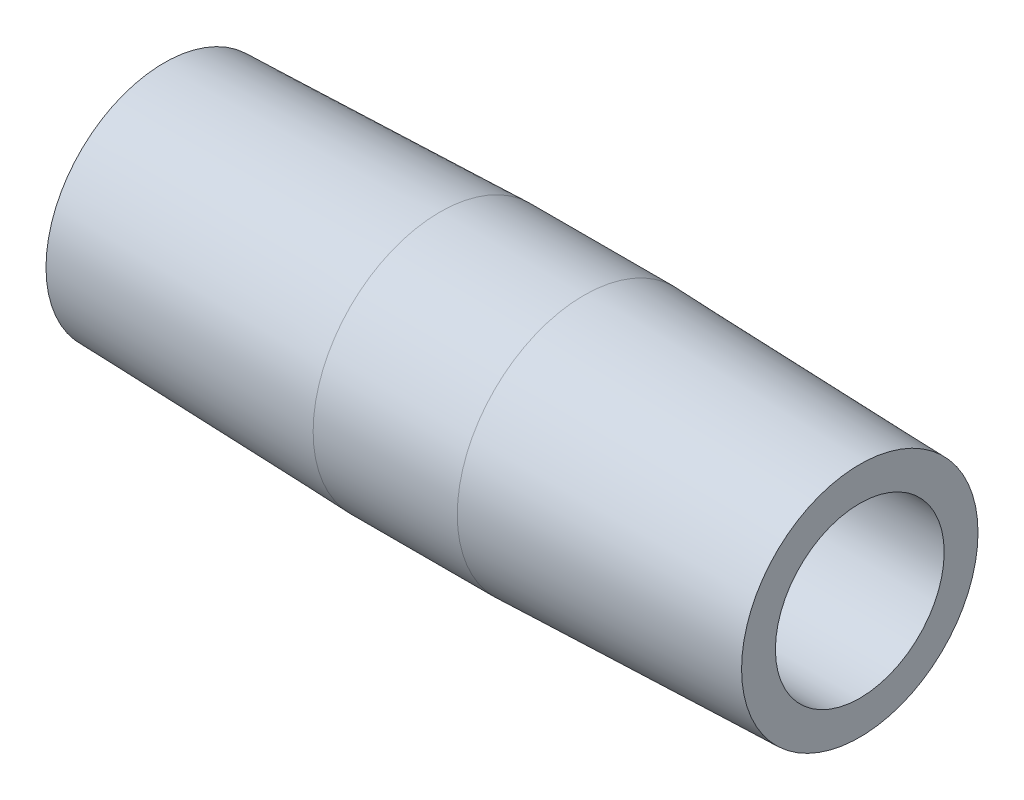
from build123d import *

# Parameters (mm, degrees)
SKETCH2_R          = 6.9453125
EXTRUDE1_DEPTH     = 15.10284
EXTRUDE1_TAPER     = 1.783333333
SKETCH11_R         = 6.9453125
EXTRUDE4_DEPTH     = 3.94716
SKETCH13_R         = 6.598046875
EXTRUDE5_DEPTH     = 1.058333333
CIRPATTERN1_COUNT  = 2
SKETCH5_R          = 4.6228
CUT_EXTRUDE3_DEPTH = 40.345708049


with BuildPart() as part:
    # Sketch2 → Extrude1 (new body)
    with BuildSketch(Plane(origin=(3.94716, 0, 0), x_dir=(0, 0, -1), z_dir=(1, 0, 0))):
        Circle(SKETCH2_R)
    extrude(amount=EXTRUDE1_DEPTH, taper=EXTRUDE1_TAPER)



with BuildPart() as body_2:
    # Sketch11 → Extrude4 (new body)
    with BuildSketch(Plane.ZY.offset(-3.94716)):
        Circle(SKETCH11_R)
    extrude(amount=EXTRUDE4_DEPTH)


with BuildPart() as part_1:
    add(part.part)

    add(body_2.part)  # Extrude5 merges body 2
    # Sketch13 → Extrude5 (add)
    with BuildSketch(Plane.ZY.offset(-3.94716)):
        Circle(SKETCH13_R)
    extrude(amount=EXTRUDE5_DEPTH)


with BuildPart() as cirpattern1_1:
    # CirPattern1: pattern copy
    add(part_1.part.rotate(Axis((0, 27.182238006, 0), (0, -1, 0)), 1 * 360 / CIRPATTERN1_COUNT))


with BuildPart() as part_2:
    add(part_1.part)

    # Combine1: union CirPattern1_1
    add(cirpattern1_1.part)

    # Sketch5 → Cut-Extrude3 (cut, through all)
    with BuildSketch(Plane(origin=(19.05, 0, 0), x_dir=(0, 0, -1), z_dir=(1, 0, 0))):
        Circle(SKETCH5_R)
    extrude(amount=-CUT_EXTRUDE3_DEPTH, mode=Mode.SUBTRACT)


solid = part_2.part
